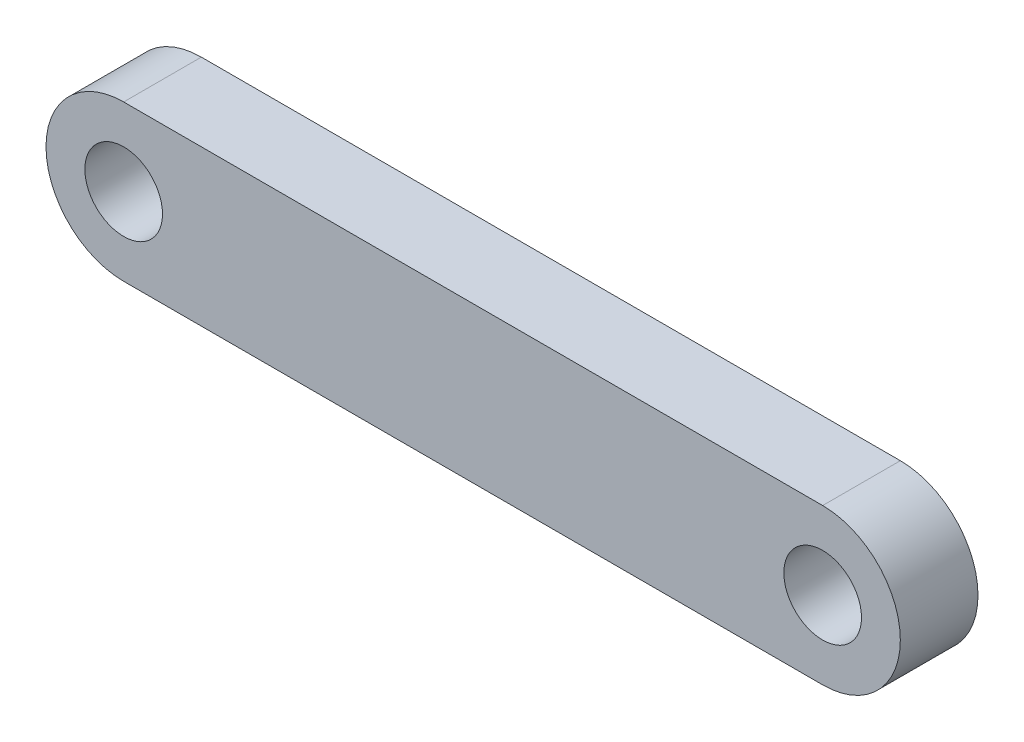
from build123d import *

# Parameters (mm, degrees)
SKETCH1_R           = 2.5
BOSS_EXTRUDE1_DEPTH = 5


with BuildPart() as part:
    # Sketch1 → Boss-Extrude1 (new body)
    with BuildSketch(Plane.XY):
        with BuildLine():
            Line((-59.996652166, 19.634073567), (-104.996652166, 19.634073567))
            ThreePointArc((-104.996652166, 19.634073567), (-109.996652166, 24.634073567), (-104.996652166, 29.634073567))
            Line((-104.996652166, 29.634073567), (-59.996652166, 29.634073567))
            ThreePointArc((-59.996652166, 29.634073567), (-54.996652166, 24.634073567), (-59.996652166, 19.634073567))
        make_face()
        with Locations((-59.996652166, 24.634073567)):
            Circle(SKETCH1_R, mode=Mode.SUBTRACT)
        with Locations((-104.996652166, 24.634073567)):
            Circle(SKETCH1_R, mode=Mode.SUBTRACT)
    extrude(amount=-BOSS_EXTRUDE1_DEPTH)


solid = part.part
